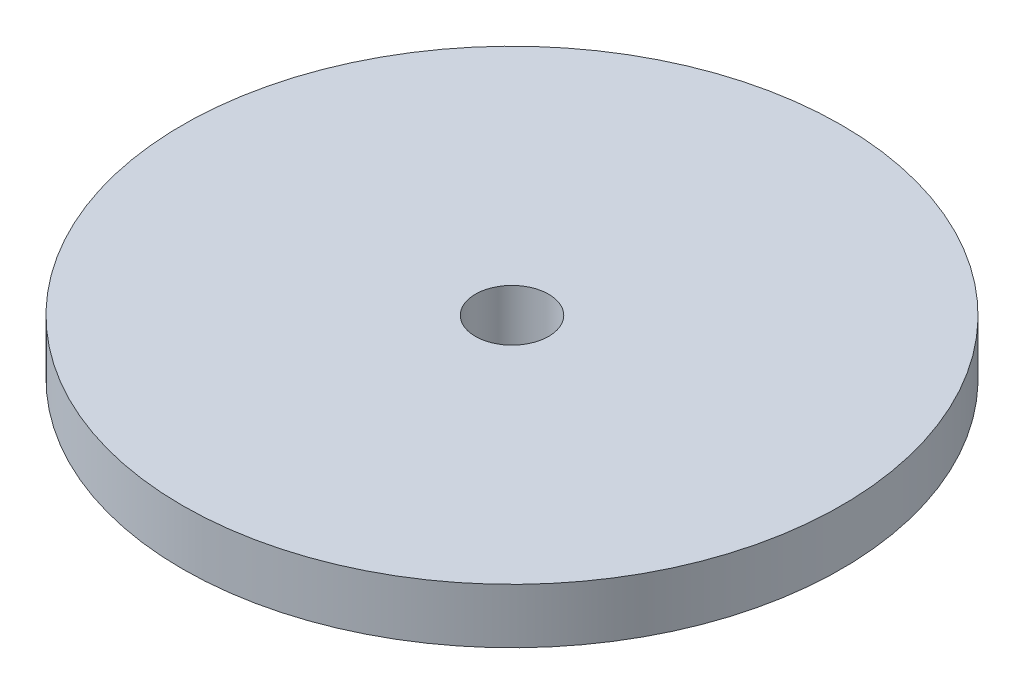
from build123d import *

# Parameters (mm, degrees)
SKETCH1_R           = 90
SKETCH1_R_2         = 10
BOSS_EXTRUDE1_DEPTH = 15


with BuildPart() as part:
    # Sketch1 → Boss-Extrude1 (new body)
    with BuildSketch(Plane(origin=(0, 0, 0), x_dir=(1, 0, 0), z_dir=(0, 1, 0))):
        with Locations(Location((0, 0, 0), (0, 0, 270))):
            Circle(SKETCH1_R)
        with Locations(Location((0, 0, 0), (0, 0, 270))):
            Circle(SKETCH1_R_2, mode=Mode.SUBTRACT)
    extrude(amount=BOSS_EXTRUDE1_DEPTH)


solid = part.part
